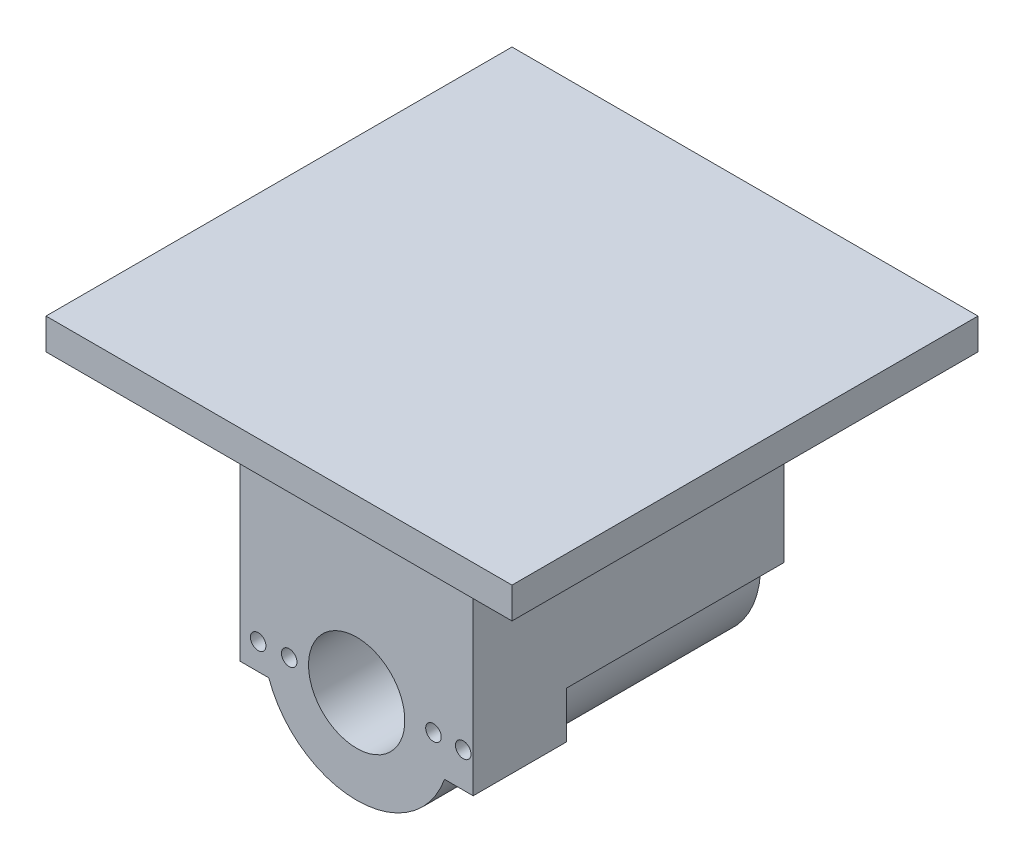
from build123d import *

# Parameters (mm, degrees)
SKETCH1_R           = 6
BOSS_EXTRUDE1_DEPTH = 20
BOSS_EXTRUDE2_START = 1
SKETCH2_W           = 15
SKETCH2_H           = 20
BOSS_EXTRUDE2_DEPTH = 5
SKETCH3_R           = 3.1
CUT_EXTRUDE1_DEPTH  = 23.186707732
BOSS_EXTRUDE3_START = -6
BOSS_EXTRUDE3_DEPTH = 6
SKETCH5_R           = 0.5
CUT_EXTRUDE2_DEPTH  = 10
SKETCH6_W           = 15
SKETCH6_H           = 20
BOSS_EXTRUDE4_DEPTH = 8
SKETCH7_W           = 30
SKETCH7_H           = 30
BOSS_EXTRUDE5_DEPTH = 2
FILLET1_R           = 3


with BuildPart() as part:
    # Sketch1 → Boss-Extrude1 (new body)
    with BuildSketch(Plane.XY):
        Circle(SKETCH1_R)
    extrude(amount=BOSS_EXTRUDE1_DEPTH)

    # Sketch2 → Boss-Extrude2 (add)
    with BuildSketch(Plane(origin=(0, 0, 0), x_dir=(1, 0, 0), z_dir=(0, 1, 0)).offset(BOSS_EXTRUDE2_START)):
        with Locations((0, -10)):
            Rectangle(SKETCH2_W, SKETCH2_H)
    extrude(amount=BOSS_EXTRUDE2_DEPTH)

    # Sketch3 → Cut-Extrude1 (cut, through all)
    with BuildSketch(Plane(origin=(0, 0, 0), x_dir=(-1, 0, 0), z_dir=(0, 0, -1))):
        Circle(SKETCH3_R)
    extrude(amount=-CUT_EXTRUDE1_DEPTH, mode=Mode.SUBTRACT)

    # Sketch4 → Boss-Extrude3 (add)
    with BuildSketch(Plane.XY.offset(20).offset(BOSS_EXTRUDE3_START)):
        with BuildLine():
            ThreePointArc((5.916079783, 1), (5.977725364, -0.516526349), (5.656854249, -2))
            Line((5.656854249, -2), (7.5, -2))
            Line((7.5, -2), (7.5, 1))
            Line((7.5, 1), (5.916079783, 1))
        make_face()
        with BuildLine():
            Line((-7.5, -2), (-5.656854249, -2))
            ThreePointArc((-5.656854249, -2), (-5.977725364, -0.516526349), (-5.916079783, 1))
            Line((-5.916079783, 1), (-7.5, 1))
            Line((-7.5, 1), (-7.5, -2))
        make_face()
    extrude(amount=BOSS_EXTRUDE3_DEPTH)

    # Sketch5 → Cut-Extrude2 (cut)
    with BuildSketch(Plane.XY.offset(20)):
        with Locations((-6.341942864, -0.319782293)):
            Circle(SKETCH5_R)
        with Locations((-4.344480544, -0.219063461)):
            Circle(SKETCH5_R)
        with Locations((4.94371924, 0.249279111)):
            Circle(SKETCH5_R)
        with Locations((6.860426101, 0.249279111)):
            Circle(SKETCH5_R)
    extrude(amount=-CUT_EXTRUDE2_DEPTH, mode=Mode.SUBTRACT)

    # Sketch6 → Boss-Extrude4 (add)
    with BuildSketch(Plane(origin=(0, 6, 0), x_dir=(1, 0, 0), z_dir=(0, 1, 0))):
        with Locations((0, -10)):
            Rectangle(SKETCH6_W, SKETCH6_H)
    extrude(amount=BOSS_EXTRUDE4_DEPTH)

    # Sketch7 → Boss-Extrude5 (add)
    with BuildSketch(Plane(origin=(0, 14, 0), x_dir=(1, 0, 0), z_dir=(0, 1, 0))):
        with Locations((0, -10)):
            Rectangle(SKETCH7_W, SKETCH7_H)
    extrude(amount=BOSS_EXTRUDE5_DEPTH)

    # Fillet1
    fillet1_edges = [part.edges().sort_by_distance(p)[0] for p in [
        (0, 14, 0),
        (-7.5, 14, 10),
        (0, 14, 20),
        (7.5, 14, 10),
    ]]
    fillet(fillet1_edges, radius=FILLET1_R)


solid = part.part
